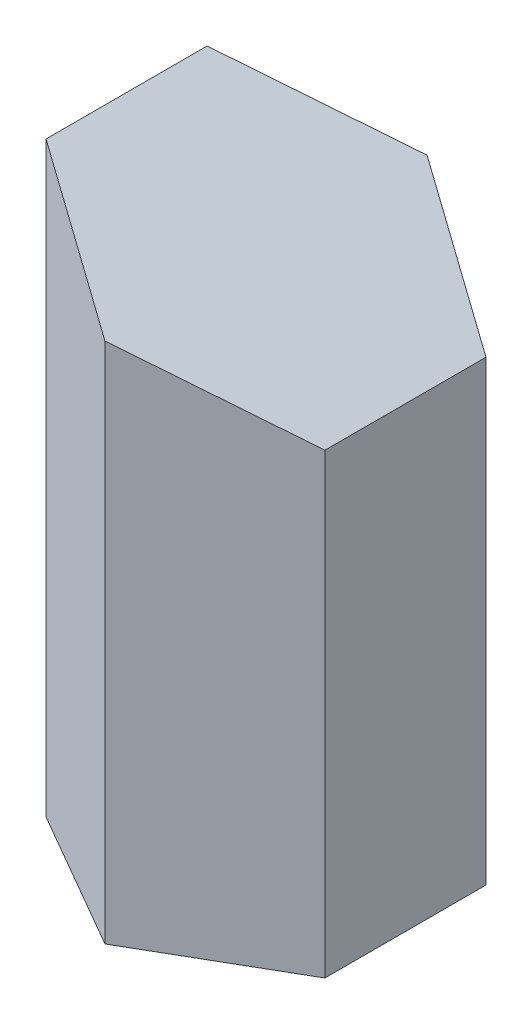
from build123d import *

# Parameters (mm, degrees)
BOSS_EXTRUDE1_DEPTH     = 40
CUT_EXTRUDE1_DEPTH      = 43.550949852
CUT_EXTRUDE1_DEPTH_BACK = 43.550949852


with BuildPart() as part:
    # Sketch1 → Boss-Extrude1 (new body)
    with BuildSketch(Plane(origin=(0, 0, 0), x_dir=(1, 0, 0), z_dir=(0, 1, 0))):
        Polygon((0, -10.969655115), (9.5, -5.484827557), (9.5, 5.484827557), (0, 10.969655115), (-9.5, 5.484827557), (-9.5, -5.484827557), align=None)
    extrude(amount=BOSS_EXTRUDE1_DEPTH)

    # Sketch2 → Cut-Extrude1 (cut, two sides: drawn at the far end of the back side and taken through both)
    with BuildSketch(Plane.XY.offset(-CUT_EXTRUDE1_DEPTH_BACK)):
        Polygon((-9.5, 40), (9.5, 31.140154495), (9.5, 40), align=None)
    extrude(amount=CUT_EXTRUDE1_DEPTH + CUT_EXTRUDE1_DEPTH_BACK, mode=Mode.SUBTRACT)


solid = part.part
